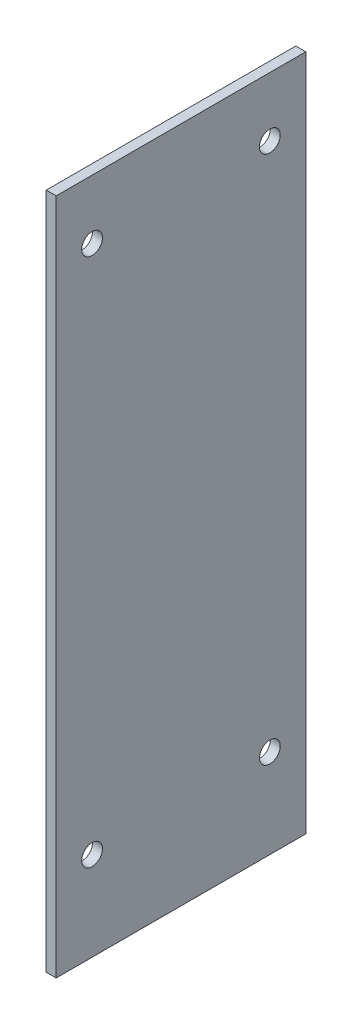
from build123d import *

# Parameters (mm, degrees)
SKETCH1_W           = 42.12
SKETCH1_H           = 114.3
BOSS_EXTRUDE1_DEPTH = 1.68
SKETCH2_R           = 1.75
CUT_EXTRUDE1_DEPTH  = 117.236121752


with BuildPart() as part:
    # Sketch1 → Boss-Extrude1 (new body)
    with BuildSketch(Plane(origin=(0, 0, 0), x_dir=(0, 0, -1), z_dir=(1, 0, 0))):
        with Locations((0, 57.15)):
            Rectangle(SKETCH1_W, SKETCH1_H)
    extrude(amount=BOSS_EXTRUDE1_DEPTH)

    # Sketch2 → Cut-Extrude1 (cut, through all)
    with BuildSketch(Plane(origin=(1.68, 0, 0), x_dir=(0, 0, -1), z_dir=(1, 0, 0))):
        with Locations((-15, 104.3)):
            Circle(SKETCH2_R)
        with Locations((15, 104.3)):
            Circle(SKETCH2_R)
        with Locations((15, 15)):
            Circle(SKETCH2_R)
        with Locations((-15, 15)):
            Circle(SKETCH2_R)
    extrude(amount=-CUT_EXTRUDE1_DEPTH, mode=Mode.SUBTRACT)


solid = part.part
